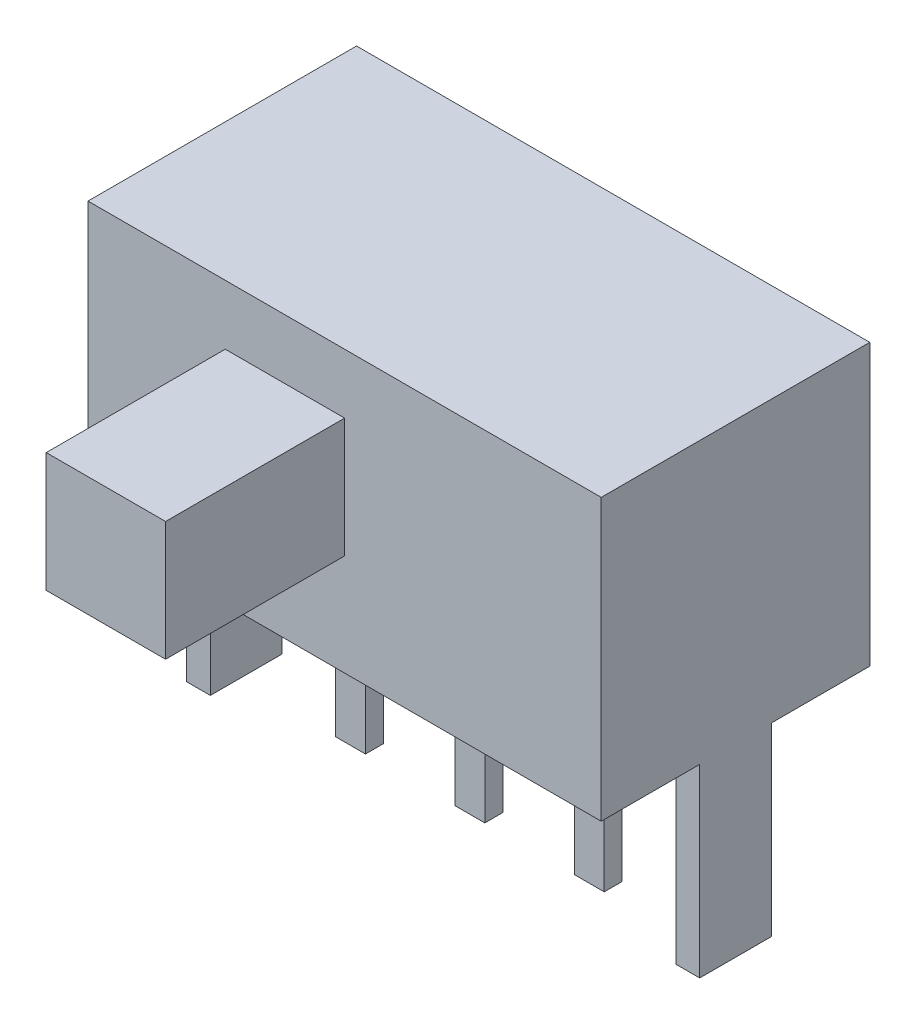
from build123d import *

# Parameters (mm, degrees)
SKETCH_1_W      = 8.6
SKETCH_1_H      = 4.5
EXTRUDE_1_DEPTH = 4.7
SKETCH_2_W      = 2
SKETCH_2_H      = 2
EXTRUDE_2_DEPTH = 3
SKETCH_4_W      = 0.4
SKETCH_4_H      = 1.2
EXTRUDE_3_DEPTH = 3.1
SKETCH_5_W      = 0.5
SKETCH_5_H      = 0.3
EXTRUDE_4_DEPTH = 3.1


with BuildPart() as part:
    # 草图1 → 凸台-拉伸1 (new body)
    with BuildSketch(Plane(origin=(0, 0, 0), x_dir=(1, 0, 0), z_dir=(0, 1, 0))):
        with Locations((4.3, 2.25)):
            Rectangle(SKETCH_1_W, SKETCH_1_H)
    extrude(amount=EXTRUDE_1_DEPTH)

    # 草图2 → 凸台-拉伸2 (add)
    with BuildSketch(Plane.XY):
        with Locations((3.3, 2.7)):
            Rectangle(SKETCH_2_W, SKETCH_2_H)
    extrude(amount=EXTRUDE_2_DEPTH)

    # 草图4 → 凸台-拉伸3 (add)
    with BuildSketch(Plane.XZ):
        with Locations((0.2, -2.25)):
            Rectangle(SKETCH_4_W, SKETCH_4_H)
        with Locations((8.4, -2.25)):
            Rectangle(SKETCH_4_W, SKETCH_4_H)
    extrude(amount=EXTRUDE_3_DEPTH)

    # 草图5 → 凸台-拉伸4 (add)
    with BuildSketch(Plane.XZ):
        with Locations((4.3, -2.25)):
            Rectangle(SKETCH_5_W, SKETCH_5_H)
        with Locations((6.3, -2.25)):
            Rectangle(SKETCH_5_W, SKETCH_5_H)
        with Locations((2.3, -2.25)):
            Rectangle(SKETCH_5_W, SKETCH_5_H)
    extrude(amount=EXTRUDE_4_DEPTH)


solid = part.part
